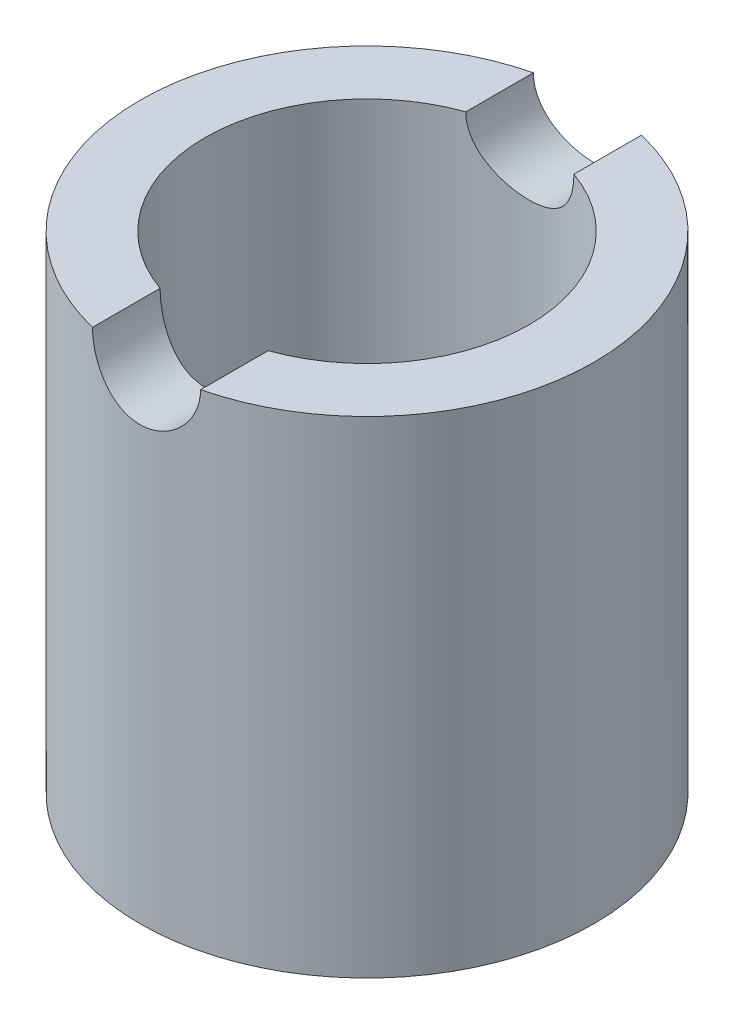
from build123d import *

# Parameters (mm, degrees)
SKETCH_1_R          = 4.2
SKETCH_1_R_2        = 3
EXTRUDE_1_DEPTH     = 13.5
CUT_EXTRUDE_START   = -1
SKETCH_3_R          = 4.2
CUT_EXTRUDE_3_DEPTH = 1
SKETCH_4_R          = 1
CUT_EXTRUDE_4_DEPTH = 50
MOVE_FACE_1_BY      = 3.5


with BuildPart() as part:
    # ｽｹｯﾁ1 → ﾎﾞｽ - 押し出し1 (new body)
    with BuildSketch(Plane(origin=(0, 0, 0), x_dir=(1, 0, 0), z_dir=(0, 1, 0))):
        with Locations(Location((0, 0, 0), (0, 0, 270))):
            Circle(SKETCH_1_R)
        with Locations(Location((0, 0, 0), (0, 0, 270))):
            Circle(SKETCH_1_R_2, mode=Mode.SUBTRACT)
    extrude(amount=EXTRUDE_1_DEPTH)

    # ｽｹｯﾁ3 → ｶｯﾄ - 押し出し3 (cut)
    with BuildSketch(Plane(origin=(0, 13.5, 0), x_dir=(1, 0, 0), z_dir=(0, 1, 0)).offset(CUT_EXTRUDE_START)):
        with Locations(Location((0, 0, 0), (0, 0, 270))):
            Circle(SKETCH_3_R)
    extrude(amount=CUT_EXTRUDE_3_DEPTH, mode=Mode.SUBTRACT)

    # ｽｹｯﾁ4 → ｶｯﾄ - 押し出し4 (cut, symmetric)
    with BuildSketch(Plane.XY):
        with Locations((0, 12.5)):
            Circle(SKETCH_4_R)
    extrude(amount=CUT_EXTRUDE_4_DEPTH, both=True, mode=Mode.SUBTRACT)

    # Move Face 1: a face moved inward by 3.5
    extrude(part.faces().sort_by_distance((0, 0, 3.36))[0], amount=MOVE_FACE_1_BY, dir=(0, 1, 0), mode=Mode.SUBTRACT)


solid = part.part
